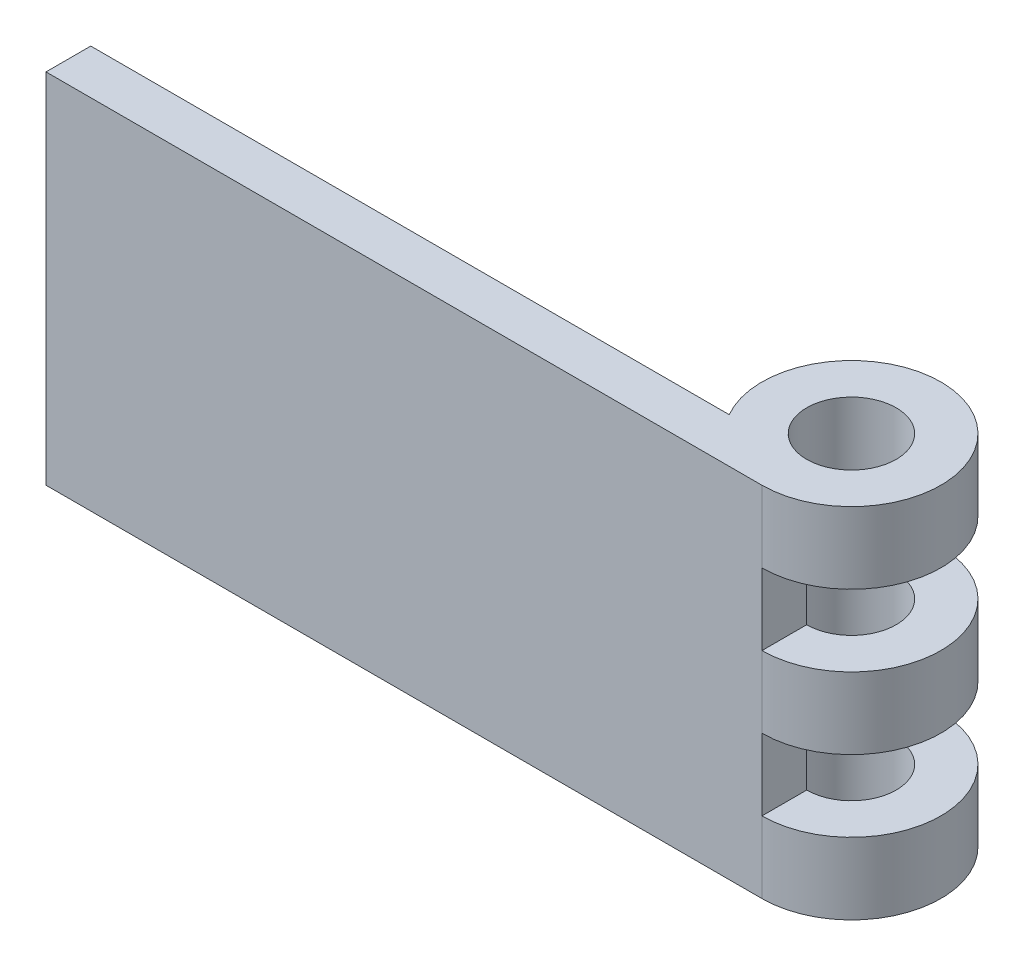
from build123d import *

# Parameters (mm, degrees)
SKETCH1_W           = 50.8
SKETCH1_H           = 3.175
BOSS_EXTRUDE1_DEPTH = 25.4
SKETCH2_R           = 6.35
SKETCH2_R_2         = 3.175
BOSS_EXTRUDE2_DEPTH = 5.08
LPATTERN1_COUNT     = 3
LPATTERN1_PITCH     = 10.16


with BuildPart() as part:
    # Sketch1 → Boss-Extrude1 (new body)
    with BuildSketch(Plane(origin=(0, 0, 0), x_dir=(1, 0, 0), z_dir=(0, 1, 0))):
        with Locations((25.4, 1.5875)):
            Rectangle(SKETCH1_W, SKETCH1_H)
    extrude(amount=BOSS_EXTRUDE1_DEPTH)

    # Sketch2 → Boss-Extrude2 (add)
    with BuildSketch(Plane(origin=(0, 25.4, 0), x_dir=(1, 0, 0), z_dir=(0, 1, 0))):
        with Locations((50.8, 6.35)):
            Circle(SKETCH2_R)
        with Locations(Location((50.8, 6.35, 0), (0, 0, 270))):
            Circle(SKETCH2_R_2, mode=Mode.SUBTRACT)
    boss_extrude2 = extrude(amount=-BOSS_EXTRUDE2_DEPTH)

    # LPattern1: Boss-Extrude2 ×3
    with Locations(*[(0, -i * LPATTERN1_PITCH, 0) for i in range(1, LPATTERN1_COUNT)]):
        add(boss_extrude2)


solid = part.part
